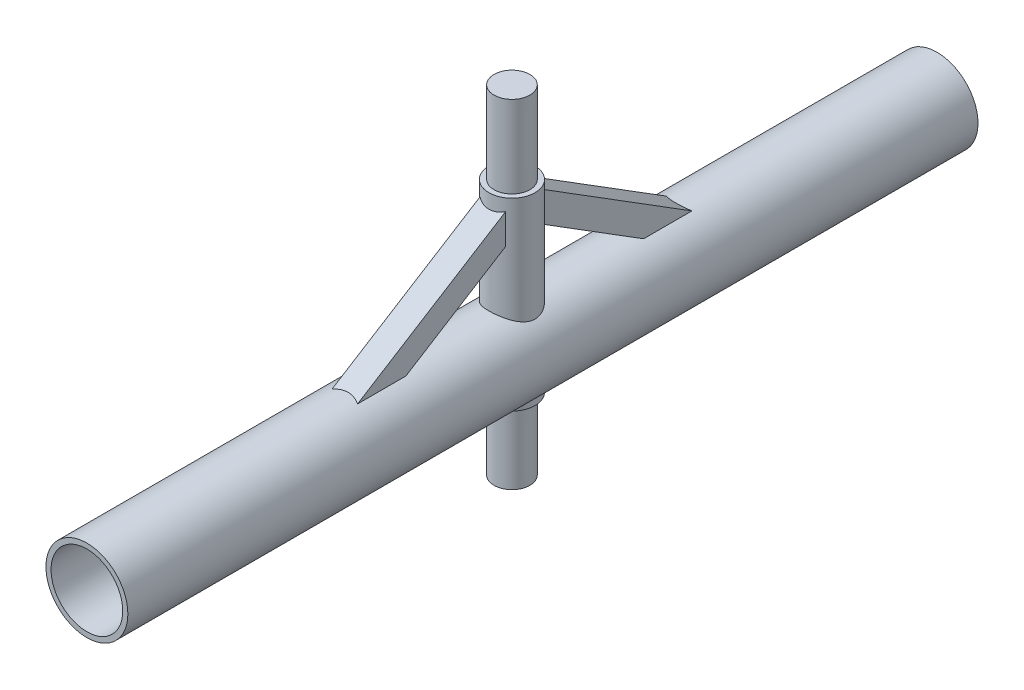
from build123d import *

# Parameters (mm, degrees)
SKETCH1_R                = 40
SKETCH1_R_2              = 35
EXTRUDE_THIN1_DEPTH      = 415
EXTRUDE_THIN2_DEPTH      = 140
EXTRUDE_THIN2_DEPTH_BACK = 40
SKETCH2_R                = 22.5
SKETCH2_R_2              = 17.5
BOSS_EXTRUDE1_DEPTH      = 80
BOSS_EXTRUDE1_DEPTH_BACK = 250
SKETCH3_R                = 17.5
EXTRUDE_THIN3_DEPTH      = 12.5
SKETCH5_R                = 35
CUT_EXTRUDE1_DEPTH       = 846


with BuildPart() as part:
    # Sketch1 → Extrude-Thin1 (new, symmetric)
    with BuildSketch(Plane.XY):
        Circle(SKETCH1_R)
        Circle(SKETCH1_R_2, mode=Mode.SUBTRACT)
    extrude(amount=EXTRUDE_THIN1_DEPTH, both=True)

    # Sketch2 → Extrude-Thin2 (add, two sides: drawn at the far end of the back side and taken through both)
    with BuildSketch(Plane(origin=(0, 0, 0), x_dir=(1, 0, 0), z_dir=(0, 1, 0)).offset(-EXTRUDE_THIN2_DEPTH_BACK)):
        Circle(SKETCH2_R)
        Circle(SKETCH2_R_2, mode=Mode.SUBTRACT)
    extrude(amount=EXTRUDE_THIN2_DEPTH + EXTRUDE_THIN2_DEPTH_BACK)

    # Sketch3 → Boss-Extrude1 (add, two sides: drawn at the far end of the back side and taken through both)
    with BuildSketch(Plane(origin=(0, 140, 0), x_dir=(1, 0, 0), z_dir=(0, 1, 0)).offset(-BOSS_EXTRUDE1_DEPTH_BACK)):
        with Locations(Location((0, 0, 0), (0, 0, 270))):
            Circle(SKETCH3_R)
    extrude(amount=BOSS_EXTRUDE1_DEPTH + BOSS_EXTRUDE1_DEPTH_BACK)


with BuildPart() as body_2:
    # Sketch4 → Extrude-Thin3 (new, symmetric)
    with BuildSketch(Plane(origin=(0, 0, 0), x_dir=(0, 0, -1), z_dir=(1, 0, 0))):
        Polygon((0, 140), (-200, 15), (-186.7500265, -6.1999576), (13.2499735, 118.8000424), align=None)
    extrude(amount=EXTRUDE_THIN3_DEPTH, both=True)


with BuildPart() as body_3:
    # Mirror1: mirrored copy
    add(body_2.part.mirror(Plane.XY))


with BuildPart() as cut_extrude1_tool:
    # Sketch5 → Cut-Extrude1 (new body)
    with BuildSketch(Plane(origin=(0, 0, -415), x_dir=(-1, 0, 0), z_dir=(0, 0, -1))):
        with Locations(Location((0, 0, 0), (0, 0, 180))):
            Circle(SKETCH5_R)
    extrude(amount=-CUT_EXTRUDE1_DEPTH)


with BuildPart() as part_1:
    add(part.part)

    # Cut-Extrude1: cut by cut_extrude1_tool
    add(cut_extrude1_tool.part, mode=Mode.SUBTRACT)


with BuildPart() as body_2_1:
    add(body_2.part)

    # Cut-Extrude1: cut by cut_extrude1_tool
    add(cut_extrude1_tool.part, mode=Mode.SUBTRACT)


with BuildPart() as body_3_1:
    add(body_3.part)

    # Cut-Extrude1: cut by cut_extrude1_tool
    add(cut_extrude1_tool.part, mode=Mode.SUBTRACT)


solid = Compound([part_1.part, body_2_1.part, body_3_1.part])
